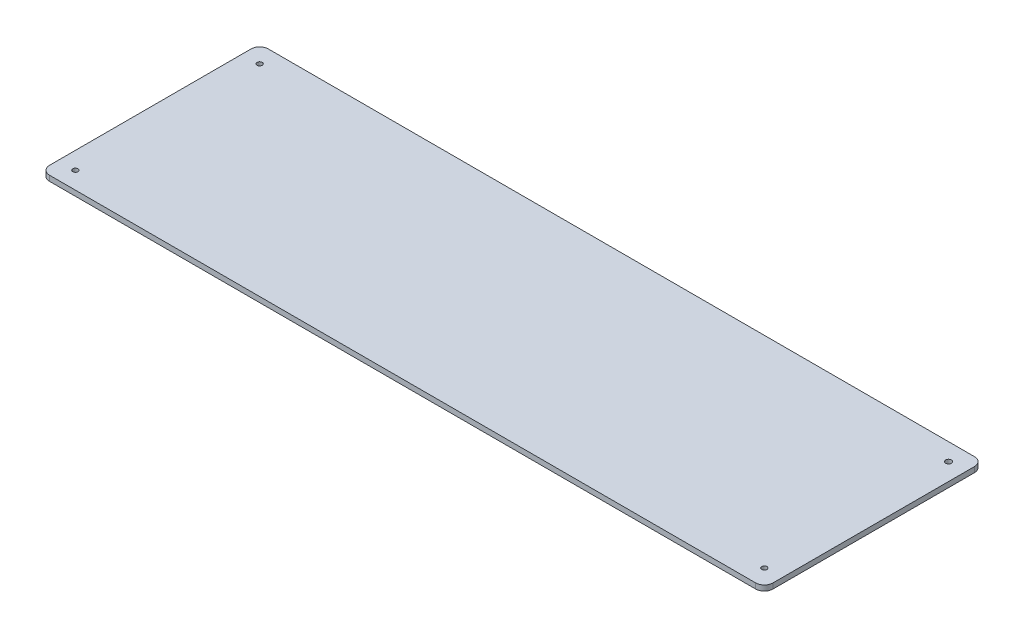
from build123d import *

# Parameters (mm, degrees)
SKETCH1_W           = 420
SKETCH1_H           = 127
BOSS_EXTRUDE1_DEPTH = 3.1
FILLET1_R           = 5
SKETCH3_R           = 1.5
SKETCH3_R_2         = 1.68611488
CUT_EXTRUDE1_DEPTH  = 3.1


with BuildPart() as part:
    # Sketch1 → Boss-Extrude1 (new body)
    with BuildSketch(Plane(origin=(0, 0, 0), x_dir=(1, 0, 0), z_dir=(0, 1, 0))):
        Rectangle(SKETCH1_W, SKETCH1_H)
    extrude(amount=BOSS_EXTRUDE1_DEPTH)

    # Fillet1
    fillet1_edges = [part.edges().sort_by_distance(p)[0] for p in [
        (210, 1.55, 63.5),
        (-210, 1.55, 63.5),
        (-210, 1.55, -63.5),
        (210, 1.55, -63.5),
    ]]
    fillet(fillet1_edges, radius=FILLET1_R)

    # Sketch3 → Cut-Extrude1 (cut)
    with BuildSketch(Plane(origin=(0, 3.1, 0), x_dir=(1, 0, 0), z_dir=(0, 1, 0))):
        with Locations(Location((-200, 53.5, 0), (0, 0, 270))):
            Circle(SKETCH3_R)
        with Locations(Location((-200, -53.5, 0), (0, 0, 270))):
            Circle(SKETCH3_R)
        with Locations(Location((200, 53.5, 0), (0, 0, 270))):
            Circle(SKETCH3_R_2)
        with Locations(Location((200, -53.5, 0), (0, 0, 270))):
            Circle(SKETCH3_R)
    extrude(amount=-CUT_EXTRUDE1_DEPTH, mode=Mode.SUBTRACT)


solid = part.part
